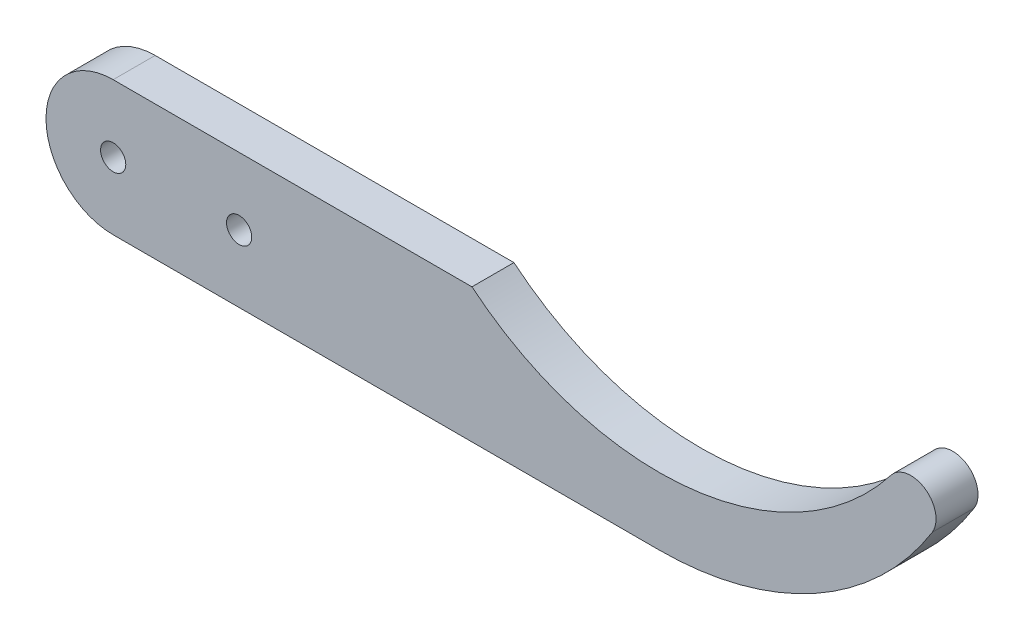
from build123d import *

# Parameters (mm, degrees)
ESQUISSE1_R        = 1.5
BOSS_EXTRU_1_DEPTH = 5


with BuildPart() as part:
    # Esquisse1 → Boss.-Extru.1 (new body)
    with BuildSketch(Plane.XY):
        with BuildLine():
            Line((0, 8), (20, 8))
            Line((20, 8), (27.728942549, 8))
            ThreePointArc((27.728942549, 8), (53.84637819, 0.211993808), (77.631578947, 13.517545651))
            ThreePointArc((77.631578947, 13.517545651), (81.714862069, 14.137746418), (82.547938522, 10.092522856))
            ThreePointArc((82.547938522, 10.092522856), (68.619262105, -3.172854276), (50, -8))
            Line((50, -8), (0, -8))
            Line((0, -8), (-15, -8))
            ThreePointArc((-15, -8), (-23, 0), (-15, 8))
            Line((-15, 8), (0, 8))
        make_face()
        Circle(ESQUISSE1_R, mode=Mode.SUBTRACT)
        with Locations((-15, 0)):
            Circle(ESQUISSE1_R, mode=Mode.SUBTRACT)
    extrude(amount=BOSS_EXTRU_1_DEPTH)


solid = part.part
